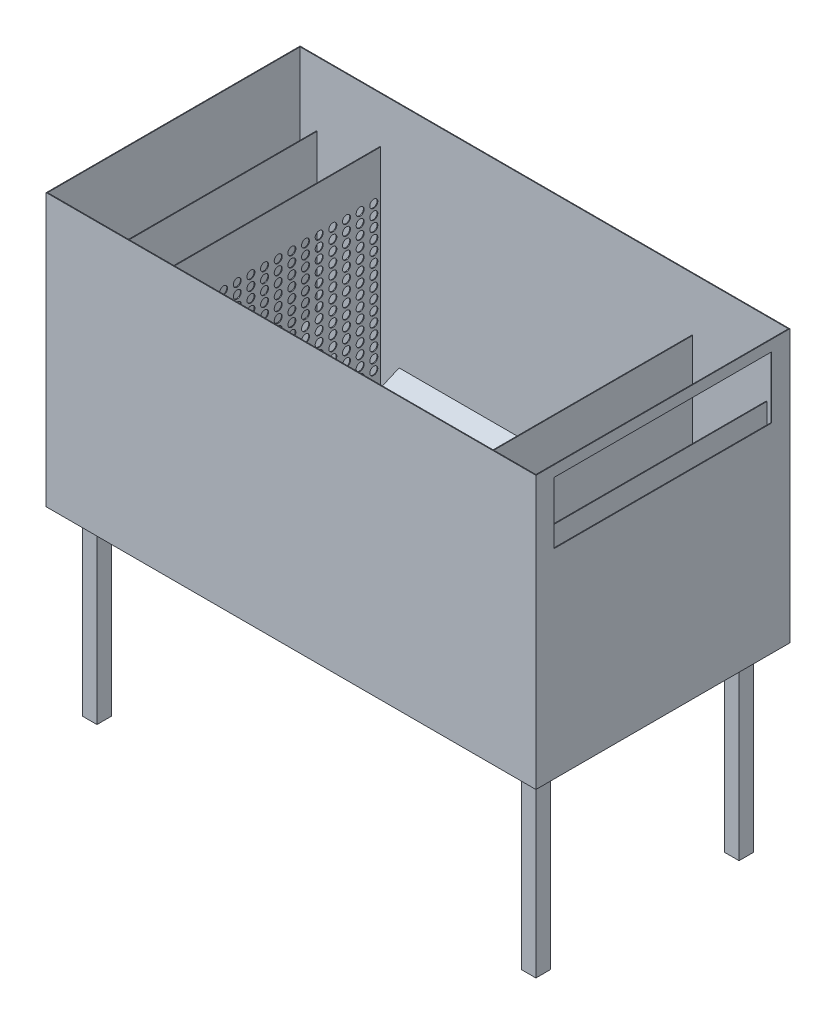
from build123d import *

# Parameters (mm, degrees)
MASTER_FOOTPRINT_W            = 1350
MASTER_FOOTPRINT_H            = 700
BATH_BASE_PLATE_DEPTH         = 750
BATH_SHELL_2MM_T              = -2
SKETCH_1_R                    = 50
INLET_D100_OPENING_DEPTH      = 10
INLET_IMPACT_BAFFLE_START     = 125
SKETCH_2_W                    = 540
SKETCH_2_H                    = 430
INLET_IMPACT_BAFFLE_DEPTH     = 2
DISTRIBUTOR_D22_START         = 250
SKETCH_3_W                    = 640
SKETCH_3_H                    = 648
SKETCH_3_R                    = 11
DISTRIBUTOR_D22_DEPTH         = 2
OUTLET_SUBMERGED_BAFFLE_START = 1130
SKETCH_4_W                    = 600
SKETCH_4_H                    = 330
OUTLET_SUBMERGED_BAFFLE_DEPTH = 2
OVERFLOW_WEIR_Z550_START      = 1290
SKETCH_5_W                    = 690
SKETCH_5_H                    = 548
OVERFLOW_WEIR_Z550_DEPTH      = 2
OUTLET_WEIR_SLOT_W600_START   = 1345
SKETCH_6_W                    = 600
SKETCH_6_H                    = 170
OUTLET_WEIR_SLOT_W600_DEPTH   = 10
SLOPED_SEDIMENT_FLOOR_START   = 275
SLOPED_SEDIMENT_FLOOR_DEPTH   = 825
SKETCH_8_W                    = 40
SKETCH_8_H                    = 40
FRAME_FOUR_LEGS_40X40_DEPTH   = 500
FRAME_FOUR_LEGS_40X40_2_DEPTH = 500
FRAME_FOUR_LEGS_40X40_3_DEPTH = 500
FRAME_FOUR_LEGS_40X40_4_DEPTH = 500


with BuildPart() as part:
    # MASTER_FOOTPRINT → BATH_BASE_PLATE (new body)
    with BuildSketch(Plane(origin=(0, 0, 0), x_dir=(1, 0, 0), z_dir=(0, 1, 0))):
        with Locations((675, 350)):
            Rectangle(MASTER_FOOTPRINT_W, MASTER_FOOTPRINT_H)
    extrude(amount=BATH_BASE_PLATE_DEPTH)

    # BATH_SHELL_2MM
    bath_shell_2mm_openings = [part.faces().sort_by_distance(p)[0] for p in [
        (675, 750, -350),
    ]]
    offset(amount=BATH_SHELL_2MM_T, openings=bath_shell_2mm_openings, kind=Kind.INTERSECTION)

    # Эскиз1 → INLET_D100_OPENING (cut)
    with BuildSketch(Plane(origin=(0, 0, 0), x_dir=(0, 0, -1), z_dir=(1, 0, 0))):
        with Locations((350, 420)):
            Circle(SKETCH_1_R)
    extrude(amount=INLET_D100_OPENING_DEPTH, mode=Mode.SUBTRACT)

    # Эскиз6 → OUTLET_WEIR_SLOT_W600 (cut)
    with BuildSketch(Plane(origin=(0, 0, 0), x_dir=(0, 0, -1), z_dir=(1, 0, 0)).offset(OUTLET_WEIR_SLOT_W600_START)):
        with Locations((350, 635)):
            Rectangle(SKETCH_6_W, SKETCH_6_H)
    extrude(amount=OUTLET_WEIR_SLOT_W600_DEPTH, mode=Mode.SUBTRACT)

    # Эскиз7 → SLOPED_SEDIMENT_FLOOR (add)
    with BuildSketch(Plane(origin=(0, 0, 0), x_dir=(0, 0, -1), z_dir=(1, 0, 0)).offset(SLOPED_SEDIMENT_FLOOR_START)):
        Polygon((2, -1), (2, 120), (280, -1), align=None)
        Polygon((698, -1), (698, 120), (420, -1), align=None)
    extrude(amount=SLOPED_SEDIMENT_FLOOR_DEPTH)


with BuildPart() as body_2:
    # Эскиз2 → INLET_IMPACT_BAFFLE (new body)
    with BuildSketch(Plane(origin=(0, 0, 0), x_dir=(0, 0, -1), z_dir=(1, 0, 0)).offset(INLET_IMPACT_BAFFLE_START)):
        with Locations((350, 435)):
            Rectangle(SKETCH_2_W, SKETCH_2_H)
    extrude(amount=INLET_IMPACT_BAFFLE_DEPTH)


with BuildPart() as body_3:
    # Эскиз3 → DISTRIBUTOR_D22 (new body)
    with BuildSketch(Plane(origin=(0, 0, 0), x_dir=(0, 0, -1), z_dir=(1, 0, 0)).offset(DISTRIBUTOR_D22_START)):
        with Locations((350, 326)):
            Rectangle(SKETCH_3_W, SKETCH_3_H)
        with Locations((48.823529412, 125)):
            Circle(SKETCH_3_R, mode=Mode.SUBTRACT)
        with Locations((48.823529412, 153.5)):
            Circle(SKETCH_3_R, mode=Mode.SUBTRACT)
        with Locations((48.823529412, 182)):
            Circle(SKETCH_3_R, mode=Mode.SUBTRACT)
        with Locations((48.823529412, 210.5)):
            Circle(SKETCH_3_R, mode=Mode.SUBTRACT)
        with Locations((48.823529412, 239)):
            Circle(SKETCH_3_R, mode=Mode.SUBTRACT)
        with Locations((48.823529412, 267.5)):
            Circle(SKETCH_3_R, mode=Mode.SUBTRACT)
        with Locations((48.823529412, 296)):
            Circle(SKETCH_3_R, mode=Mode.SUBTRACT)
        with Locations((48.823529412, 324.5)):
            Circle(SKETCH_3_R, mode=Mode.SUBTRACT)
        with Locations((48.823529412, 353)):
            Circle(SKETCH_3_R, mode=Mode.SUBTRACT)
        with Locations((48.823529412, 381.5)):
            Circle(SKETCH_3_R, mode=Mode.SUBTRACT)
        with Locations((48.823529412, 410)):
            Circle(SKETCH_3_R, mode=Mode.SUBTRACT)
        with Locations((48.823529412, 438.5)):
            Circle(SKETCH_3_R, mode=Mode.SUBTRACT)
        with Locations((48.823529412, 467)):
            Circle(SKETCH_3_R, mode=Mode.SUBTRACT)
        with Locations((48.823529412, 495.5)):
            Circle(SKETCH_3_R, mode=Mode.SUBTRACT)
        with Locations((48.823529412, 524)):
            Circle(SKETCH_3_R, mode=Mode.SUBTRACT)
        with Locations((86.470588235, 125)):
            Circle(SKETCH_3_R, mode=Mode.SUBTRACT)
        with Locations((86.470588235, 153.5)):
            Circle(SKETCH_3_R, mode=Mode.SUBTRACT)
        with Locations((86.470588235, 182)):
            Circle(SKETCH_3_R, mode=Mode.SUBTRACT)
        with Locations((86.470588235, 210.5)):
            Circle(SKETCH_3_R, mode=Mode.SUBTRACT)
        with Locations((86.470588235, 239)):
            Circle(SKETCH_3_R, mode=Mode.SUBTRACT)
        with Locations((86.470588235, 267.5)):
            Circle(SKETCH_3_R, mode=Mode.SUBTRACT)
        with Locations((86.470588235, 296)):
            Circle(SKETCH_3_R, mode=Mode.SUBTRACT)
        with Locations((86.470588235, 324.5)):
            Circle(SKETCH_3_R, mode=Mode.SUBTRACT)
        with Locations((86.470588235, 353)):
            Circle(SKETCH_3_R, mode=Mode.SUBTRACT)
        with Locations((86.470588235, 381.5)):
            Circle(SKETCH_3_R, mode=Mode.SUBTRACT)
        with Locations((86.470588235, 410)):
            Circle(SKETCH_3_R, mode=Mode.SUBTRACT)
        with Locations((86.470588235, 438.5)):
            Circle(SKETCH_3_R, mode=Mode.SUBTRACT)
        with Locations((86.470588235, 467)):
            Circle(SKETCH_3_R, mode=Mode.SUBTRACT)
        with Locations((86.470588235, 495.5)):
            Circle(SKETCH_3_R, mode=Mode.SUBTRACT)
        with Locations((86.470588235, 524)):
            Circle(SKETCH_3_R, mode=Mode.SUBTRACT)
        with Locations((124.117647059, 125)):
            Circle(SKETCH_3_R, mode=Mode.SUBTRACT)
        with Locations((124.117647059, 153.5)):
            Circle(SKETCH_3_R, mode=Mode.SUBTRACT)
        with Locations((124.117647059, 182)):
            Circle(SKETCH_3_R, mode=Mode.SUBTRACT)
        with Locations((124.117647059, 210.5)):
            Circle(SKETCH_3_R, mode=Mode.SUBTRACT)
        with Locations((124.117647059, 239)):
            Circle(SKETCH_3_R, mode=Mode.SUBTRACT)
        with Locations((124.117647059, 267.5)):
            Circle(SKETCH_3_R, mode=Mode.SUBTRACT)
        with Locations((124.117647059, 296)):
            Circle(SKETCH_3_R, mode=Mode.SUBTRACT)
        with Locations((124.117647059, 324.5)):
            Circle(SKETCH_3_R, mode=Mode.SUBTRACT)
        with Locations((124.117647059, 353)):
            Circle(SKETCH_3_R, mode=Mode.SUBTRACT)
        with Locations((124.117647059, 381.5)):
            Circle(SKETCH_3_R, mode=Mode.SUBTRACT)
        with Locations((124.117647059, 410)):
            Circle(SKETCH_3_R, mode=Mode.SUBTRACT)
        with Locations((124.117647059, 438.5)):
            Circle(SKETCH_3_R, mode=Mode.SUBTRACT)
        with Locations((124.117647059, 467)):
            Circle(SKETCH_3_R, mode=Mode.SUBTRACT)
        with Locations((124.117647059, 495.5)):
            Circle(SKETCH_3_R, mode=Mode.SUBTRACT)
        with Locations((124.117647059, 524)):
            Circle(SKETCH_3_R, mode=Mode.SUBTRACT)
        with Locations((161.764705882, 125)):
            Circle(SKETCH_3_R, mode=Mode.SUBTRACT)
        with Locations((161.764705882, 153.5)):
            Circle(SKETCH_3_R, mode=Mode.SUBTRACT)
        with Locations((161.764705882, 182)):
            Circle(SKETCH_3_R, mode=Mode.SUBTRACT)
        with Locations((161.764705882, 210.5)):
            Circle(SKETCH_3_R, mode=Mode.SUBTRACT)
        with Locations((161.764705882, 239)):
            Circle(SKETCH_3_R, mode=Mode.SUBTRACT)
        with Locations((161.764705882, 267.5)):
            Circle(SKETCH_3_R, mode=Mode.SUBTRACT)
        with Locations((161.764705882, 296)):
            Circle(SKETCH_3_R, mode=Mode.SUBTRACT)
        with Locations((161.764705882, 324.5)):
            Circle(SKETCH_3_R, mode=Mode.SUBTRACT)
        with Locations((161.764705882, 353)):
            Circle(SKETCH_3_R, mode=Mode.SUBTRACT)
        with Locations((161.764705882, 381.5)):
            Circle(SKETCH_3_R, mode=Mode.SUBTRACT)
        with Locations((161.764705882, 410)):
            Circle(SKETCH_3_R, mode=Mode.SUBTRACT)
        with Locations((161.764705882, 438.5)):
            Circle(SKETCH_3_R, mode=Mode.SUBTRACT)
        with Locations((161.764705882, 467)):
            Circle(SKETCH_3_R, mode=Mode.SUBTRACT)
        with Locations((161.764705882, 495.5)):
            Circle(SKETCH_3_R, mode=Mode.SUBTRACT)
        with Locations((161.764705882, 524)):
            Circle(SKETCH_3_R, mode=Mode.SUBTRACT)
        with Locations((199.411764706, 125)):
            Circle(SKETCH_3_R, mode=Mode.SUBTRACT)
        with Locations((199.411764706, 153.5)):
            Circle(SKETCH_3_R, mode=Mode.SUBTRACT)
        with Locations((199.411764706, 182)):
            Circle(SKETCH_3_R, mode=Mode.SUBTRACT)
        with Locations((199.411764706, 210.5)):
            Circle(SKETCH_3_R, mode=Mode.SUBTRACT)
        with Locations((199.411764706, 239)):
            Circle(SKETCH_3_R, mode=Mode.SUBTRACT)
        with Locations((199.411764706, 267.5)):
            Circle(SKETCH_3_R, mode=Mode.SUBTRACT)
        with Locations((199.411764706, 296)):
            Circle(SKETCH_3_R, mode=Mode.SUBTRACT)
        with Locations((199.411764706, 324.5)):
            Circle(SKETCH_3_R, mode=Mode.SUBTRACT)
        with Locations((199.411764706, 353)):
            Circle(SKETCH_3_R, mode=Mode.SUBTRACT)
        with Locations((199.411764706, 381.5)):
            Circle(SKETCH_3_R, mode=Mode.SUBTRACT)
        with Locations((199.411764706, 410)):
            Circle(SKETCH_3_R, mode=Mode.SUBTRACT)
        with Locations((199.411764706, 438.5)):
            Circle(SKETCH_3_R, mode=Mode.SUBTRACT)
        with Locations((199.411764706, 467)):
            Circle(SKETCH_3_R, mode=Mode.SUBTRACT)
        with Locations((199.411764706, 495.5)):
            Circle(SKETCH_3_R, mode=Mode.SUBTRACT)
        with Locations((199.411764706, 524)):
            Circle(SKETCH_3_R, mode=Mode.SUBTRACT)
        with Locations((237.058823529, 125)):
            Circle(SKETCH_3_R, mode=Mode.SUBTRACT)
        with Locations((237.058823529, 153.5)):
            Circle(SKETCH_3_R, mode=Mode.SUBTRACT)
        with Locations((237.058823529, 182)):
            Circle(SKETCH_3_R, mode=Mode.SUBTRACT)
        with Locations((237.058823529, 210.5)):
            Circle(SKETCH_3_R, mode=Mode.SUBTRACT)
        with Locations((237.058823529, 239)):
            Circle(SKETCH_3_R, mode=Mode.SUBTRACT)
        with Locations((237.058823529, 267.5)):
            Circle(SKETCH_3_R, mode=Mode.SUBTRACT)
        with Locations((237.058823529, 296)):
            Circle(SKETCH_3_R, mode=Mode.SUBTRACT)
        with Locations((237.058823529, 324.5)):
            Circle(SKETCH_3_R, mode=Mode.SUBTRACT)
        with Locations((237.058823529, 353)):
            Circle(SKETCH_3_R, mode=Mode.SUBTRACT)
        with Locations((237.058823529, 381.5)):
            Circle(SKETCH_3_R, mode=Mode.SUBTRACT)
        with Locations((237.058823529, 410)):
            Circle(SKETCH_3_R, mode=Mode.SUBTRACT)
        with Locations((237.058823529, 438.5)):
            Circle(SKETCH_3_R, mode=Mode.SUBTRACT)
        with Locations((237.058823529, 467)):
            Circle(SKETCH_3_R, mode=Mode.SUBTRACT)
        with Locations((237.058823529, 495.5)):
            Circle(SKETCH_3_R, mode=Mode.SUBTRACT)
        with Locations((237.058823529, 524)):
            Circle(SKETCH_3_R, mode=Mode.SUBTRACT)
        with Locations((274.705882353, 125)):
            Circle(SKETCH_3_R, mode=Mode.SUBTRACT)
        with Locations((274.705882353, 153.5)):
            Circle(SKETCH_3_R, mode=Mode.SUBTRACT)
        with Locations((274.705882353, 182)):
            Circle(SKETCH_3_R, mode=Mode.SUBTRACT)
        with Locations((274.705882353, 210.5)):
            Circle(SKETCH_3_R, mode=Mode.SUBTRACT)
        with Locations((274.705882353, 239)):
            Circle(SKETCH_3_R, mode=Mode.SUBTRACT)
        with Locations((274.705882353, 267.5)):
            Circle(SKETCH_3_R, mode=Mode.SUBTRACT)
        with Locations((274.705882353, 296)):
            Circle(SKETCH_3_R, mode=Mode.SUBTRACT)
        with Locations((274.705882353, 324.5)):
            Circle(SKETCH_3_R, mode=Mode.SUBTRACT)
        with Locations((274.705882353, 353)):
            Circle(SKETCH_3_R, mode=Mode.SUBTRACT)
        with Locations((274.705882353, 381.5)):
            Circle(SKETCH_3_R, mode=Mode.SUBTRACT)
        with Locations((274.705882353, 410)):
            Circle(SKETCH_3_R, mode=Mode.SUBTRACT)
        with Locations((274.705882353, 438.5)):
            Circle(SKETCH_3_R, mode=Mode.SUBTRACT)
        with Locations((274.705882353, 467)):
            Circle(SKETCH_3_R, mode=Mode.SUBTRACT)
        with Locations((274.705882353, 495.5)):
            Circle(SKETCH_3_R, mode=Mode.SUBTRACT)
        with Locations((274.705882353, 524)):
            Circle(SKETCH_3_R, mode=Mode.SUBTRACT)
        with Locations((312.352941176, 125)):
            Circle(SKETCH_3_R, mode=Mode.SUBTRACT)
        with Locations((312.352941176, 153.5)):
            Circle(SKETCH_3_R, mode=Mode.SUBTRACT)
        with Locations((312.352941176, 182)):
            Circle(SKETCH_3_R, mode=Mode.SUBTRACT)
        with Locations((312.352941176, 210.5)):
            Circle(SKETCH_3_R, mode=Mode.SUBTRACT)
        with Locations((312.352941176, 239)):
            Circle(SKETCH_3_R, mode=Mode.SUBTRACT)
        with Locations((312.352941176, 267.5)):
            Circle(SKETCH_3_R, mode=Mode.SUBTRACT)
        with Locations((312.352941176, 296)):
            Circle(SKETCH_3_R, mode=Mode.SUBTRACT)
        with Locations((312.352941176, 324.5)):
            Circle(SKETCH_3_R, mode=Mode.SUBTRACT)
        with Locations((312.352941176, 353)):
            Circle(SKETCH_3_R, mode=Mode.SUBTRACT)
        with Locations((312.352941176, 381.5)):
            Circle(SKETCH_3_R, mode=Mode.SUBTRACT)
        with Locations((312.352941176, 410)):
            Circle(SKETCH_3_R, mode=Mode.SUBTRACT)
        with Locations((312.352941176, 438.5)):
            Circle(SKETCH_3_R, mode=Mode.SUBTRACT)
        with Locations((312.352941176, 467)):
            Circle(SKETCH_3_R, mode=Mode.SUBTRACT)
        with Locations((312.352941176, 495.5)):
            Circle(SKETCH_3_R, mode=Mode.SUBTRACT)
        with Locations((312.352941176, 524)):
            Circle(SKETCH_3_R, mode=Mode.SUBTRACT)
        with Locations((350, 125)):
            Circle(SKETCH_3_R, mode=Mode.SUBTRACT)
        with Locations((350, 153.5)):
            Circle(SKETCH_3_R, mode=Mode.SUBTRACT)
        with Locations((350, 182)):
            Circle(SKETCH_3_R, mode=Mode.SUBTRACT)
        with Locations((350, 210.5)):
            Circle(SKETCH_3_R, mode=Mode.SUBTRACT)
        with Locations((350, 239)):
            Circle(SKETCH_3_R, mode=Mode.SUBTRACT)
        with Locations((350, 267.5)):
            Circle(SKETCH_3_R, mode=Mode.SUBTRACT)
        with Locations((350, 296)):
            Circle(SKETCH_3_R, mode=Mode.SUBTRACT)
        with Locations((350, 324.5)):
            Circle(SKETCH_3_R, mode=Mode.SUBTRACT)
        with Locations((350, 353)):
            Circle(SKETCH_3_R, mode=Mode.SUBTRACT)
        with Locations((350, 381.5)):
            Circle(SKETCH_3_R, mode=Mode.SUBTRACT)
        with Locations((350, 410)):
            Circle(SKETCH_3_R, mode=Mode.SUBTRACT)
        with Locations((350, 438.5)):
            Circle(SKETCH_3_R, mode=Mode.SUBTRACT)
        with Locations((350, 467)):
            Circle(SKETCH_3_R, mode=Mode.SUBTRACT)
        with Locations((350, 495.5)):
            Circle(SKETCH_3_R, mode=Mode.SUBTRACT)
        with Locations((350, 524)):
            Circle(SKETCH_3_R, mode=Mode.SUBTRACT)
        with Locations((387.647058824, 125)):
            Circle(SKETCH_3_R, mode=Mode.SUBTRACT)
        with Locations((387.647058824, 153.5)):
            Circle(SKETCH_3_R, mode=Mode.SUBTRACT)
        with Locations((387.647058824, 182)):
            Circle(SKETCH_3_R, mode=Mode.SUBTRACT)
        with Locations((387.647058824, 210.5)):
            Circle(SKETCH_3_R, mode=Mode.SUBTRACT)
        with Locations((387.647058824, 239)):
            Circle(SKETCH_3_R, mode=Mode.SUBTRACT)
        with Locations((387.647058824, 267.5)):
            Circle(SKETCH_3_R, mode=Mode.SUBTRACT)
        with Locations((387.647058824, 296)):
            Circle(SKETCH_3_R, mode=Mode.SUBTRACT)
        with Locations((387.647058824, 324.5)):
            Circle(SKETCH_3_R, mode=Mode.SUBTRACT)
        with Locations((387.647058824, 353)):
            Circle(SKETCH_3_R, mode=Mode.SUBTRACT)
        with Locations((387.647058824, 381.5)):
            Circle(SKETCH_3_R, mode=Mode.SUBTRACT)
        with Locations((387.647058824, 410)):
            Circle(SKETCH_3_R, mode=Mode.SUBTRACT)
        with Locations((387.647058824, 438.5)):
            Circle(SKETCH_3_R, mode=Mode.SUBTRACT)
        with Locations((387.647058824, 467)):
            Circle(SKETCH_3_R, mode=Mode.SUBTRACT)
        with Locations((387.647058824, 495.5)):
            Circle(SKETCH_3_R, mode=Mode.SUBTRACT)
        with Locations((387.647058824, 524)):
            Circle(SKETCH_3_R, mode=Mode.SUBTRACT)
        with Locations((425.294117647, 125)):
            Circle(SKETCH_3_R, mode=Mode.SUBTRACT)
        with Locations((425.294117647, 153.5)):
            Circle(SKETCH_3_R, mode=Mode.SUBTRACT)
        with Locations((425.294117647, 182)):
            Circle(SKETCH_3_R, mode=Mode.SUBTRACT)
        with Locations((425.294117647, 210.5)):
            Circle(SKETCH_3_R, mode=Mode.SUBTRACT)
        with Locations((425.294117647, 239)):
            Circle(SKETCH_3_R, mode=Mode.SUBTRACT)
        with Locations((425.294117647, 267.5)):
            Circle(SKETCH_3_R, mode=Mode.SUBTRACT)
        with Locations((425.294117647, 296)):
            Circle(SKETCH_3_R, mode=Mode.SUBTRACT)
        with Locations((425.294117647, 324.5)):
            Circle(SKETCH_3_R, mode=Mode.SUBTRACT)
        with Locations((425.294117647, 353)):
            Circle(SKETCH_3_R, mode=Mode.SUBTRACT)
        with Locations((425.294117647, 381.5)):
            Circle(SKETCH_3_R, mode=Mode.SUBTRACT)
        with Locations((425.294117647, 410)):
            Circle(SKETCH_3_R, mode=Mode.SUBTRACT)
        with Locations((425.294117647, 438.5)):
            Circle(SKETCH_3_R, mode=Mode.SUBTRACT)
        with Locations((425.294117647, 467)):
            Circle(SKETCH_3_R, mode=Mode.SUBTRACT)
        with Locations((425.294117647, 495.5)):
            Circle(SKETCH_3_R, mode=Mode.SUBTRACT)
        with Locations((425.294117647, 524)):
            Circle(SKETCH_3_R, mode=Mode.SUBTRACT)
        with Locations((462.941176471, 125)):
            Circle(SKETCH_3_R, mode=Mode.SUBTRACT)
        with Locations((462.941176471, 153.5)):
            Circle(SKETCH_3_R, mode=Mode.SUBTRACT)
        with Locations((462.941176471, 182)):
            Circle(SKETCH_3_R, mode=Mode.SUBTRACT)
        with Locations((462.941176471, 210.5)):
            Circle(SKETCH_3_R, mode=Mode.SUBTRACT)
        with Locations((462.941176471, 239)):
            Circle(SKETCH_3_R, mode=Mode.SUBTRACT)
        with Locations((462.941176471, 267.5)):
            Circle(SKETCH_3_R, mode=Mode.SUBTRACT)
        with Locations((462.941176471, 296)):
            Circle(SKETCH_3_R, mode=Mode.SUBTRACT)
        with Locations((462.941176471, 324.5)):
            Circle(SKETCH_3_R, mode=Mode.SUBTRACT)
        with Locations((462.941176471, 353)):
            Circle(SKETCH_3_R, mode=Mode.SUBTRACT)
        with Locations((462.941176471, 381.5)):
            Circle(SKETCH_3_R, mode=Mode.SUBTRACT)
        with Locations((462.941176471, 410)):
            Circle(SKETCH_3_R, mode=Mode.SUBTRACT)
        with Locations((462.941176471, 438.5)):
            Circle(SKETCH_3_R, mode=Mode.SUBTRACT)
        with Locations((462.941176471, 467)):
            Circle(SKETCH_3_R, mode=Mode.SUBTRACT)
        with Locations((462.941176471, 495.5)):
            Circle(SKETCH_3_R, mode=Mode.SUBTRACT)
        with Locations((462.941176471, 524)):
            Circle(SKETCH_3_R, mode=Mode.SUBTRACT)
        with Locations((500.588235294, 125)):
            Circle(SKETCH_3_R, mode=Mode.SUBTRACT)
        with Locations((500.588235294, 153.5)):
            Circle(SKETCH_3_R, mode=Mode.SUBTRACT)
        with Locations((500.588235294, 182)):
            Circle(SKETCH_3_R, mode=Mode.SUBTRACT)
        with Locations((500.588235294, 210.5)):
            Circle(SKETCH_3_R, mode=Mode.SUBTRACT)
        with Locations((500.588235294, 239)):
            Circle(SKETCH_3_R, mode=Mode.SUBTRACT)
        with Locations((500.588235294, 267.5)):
            Circle(SKETCH_3_R, mode=Mode.SUBTRACT)
        with Locations((500.588235294, 296)):
            Circle(SKETCH_3_R, mode=Mode.SUBTRACT)
        with Locations((500.588235294, 324.5)):
            Circle(SKETCH_3_R, mode=Mode.SUBTRACT)
        with Locations((500.588235294, 353)):
            Circle(SKETCH_3_R, mode=Mode.SUBTRACT)
        with Locations((500.588235294, 381.5)):
            Circle(SKETCH_3_R, mode=Mode.SUBTRACT)
        with Locations((500.588235294, 410)):
            Circle(SKETCH_3_R, mode=Mode.SUBTRACT)
        with Locations((500.588235294, 438.5)):
            Circle(SKETCH_3_R, mode=Mode.SUBTRACT)
        with Locations((500.588235294, 467)):
            Circle(SKETCH_3_R, mode=Mode.SUBTRACT)
        with Locations((500.588235294, 495.5)):
            Circle(SKETCH_3_R, mode=Mode.SUBTRACT)
        with Locations((500.588235294, 524)):
            Circle(SKETCH_3_R, mode=Mode.SUBTRACT)
        with Locations((538.235294118, 125)):
            Circle(SKETCH_3_R, mode=Mode.SUBTRACT)
        with Locations((538.235294118, 153.5)):
            Circle(SKETCH_3_R, mode=Mode.SUBTRACT)
        with Locations((538.235294118, 182)):
            Circle(SKETCH_3_R, mode=Mode.SUBTRACT)
        with Locations((538.235294118, 210.5)):
            Circle(SKETCH_3_R, mode=Mode.SUBTRACT)
        with Locations((538.235294118, 239)):
            Circle(SKETCH_3_R, mode=Mode.SUBTRACT)
        with Locations((538.235294118, 267.5)):
            Circle(SKETCH_3_R, mode=Mode.SUBTRACT)
        with Locations((538.235294118, 296)):
            Circle(SKETCH_3_R, mode=Mode.SUBTRACT)
        with Locations((538.235294118, 324.5)):
            Circle(SKETCH_3_R, mode=Mode.SUBTRACT)
        with Locations((538.235294118, 353)):
            Circle(SKETCH_3_R, mode=Mode.SUBTRACT)
        with Locations((538.235294118, 381.5)):
            Circle(SKETCH_3_R, mode=Mode.SUBTRACT)
        with Locations((538.235294118, 410)):
            Circle(SKETCH_3_R, mode=Mode.SUBTRACT)
        with Locations((538.235294118, 438.5)):
            Circle(SKETCH_3_R, mode=Mode.SUBTRACT)
        with Locations((538.235294118, 467)):
            Circle(SKETCH_3_R, mode=Mode.SUBTRACT)
        with Locations((538.235294118, 495.5)):
            Circle(SKETCH_3_R, mode=Mode.SUBTRACT)
        with Locations((538.235294118, 524)):
            Circle(SKETCH_3_R, mode=Mode.SUBTRACT)
        with Locations((575.882352941, 125)):
            Circle(SKETCH_3_R, mode=Mode.SUBTRACT)
        with Locations((575.882352941, 153.5)):
            Circle(SKETCH_3_R, mode=Mode.SUBTRACT)
        with Locations((575.882352941, 182)):
            Circle(SKETCH_3_R, mode=Mode.SUBTRACT)
        with Locations((575.882352941, 210.5)):
            Circle(SKETCH_3_R, mode=Mode.SUBTRACT)
        with Locations((575.882352941, 239)):
            Circle(SKETCH_3_R, mode=Mode.SUBTRACT)
        with Locations((575.882352941, 267.5)):
            Circle(SKETCH_3_R, mode=Mode.SUBTRACT)
        with Locations((575.882352941, 296)):
            Circle(SKETCH_3_R, mode=Mode.SUBTRACT)
        with Locations((575.882352941, 324.5)):
            Circle(SKETCH_3_R, mode=Mode.SUBTRACT)
        with Locations((575.882352941, 353)):
            Circle(SKETCH_3_R, mode=Mode.SUBTRACT)
        with Locations((575.882352941, 381.5)):
            Circle(SKETCH_3_R, mode=Mode.SUBTRACT)
        with Locations((575.882352941, 410)):
            Circle(SKETCH_3_R, mode=Mode.SUBTRACT)
        with Locations((575.882352941, 438.5)):
            Circle(SKETCH_3_R, mode=Mode.SUBTRACT)
        with Locations((575.882352941, 467)):
            Circle(SKETCH_3_R, mode=Mode.SUBTRACT)
        with Locations((575.882352941, 495.5)):
            Circle(SKETCH_3_R, mode=Mode.SUBTRACT)
        with Locations((575.882352941, 524)):
            Circle(SKETCH_3_R, mode=Mode.SUBTRACT)
        with Locations((613.529411765, 125)):
            Circle(SKETCH_3_R, mode=Mode.SUBTRACT)
        with Locations((613.529411765, 153.5)):
            Circle(SKETCH_3_R, mode=Mode.SUBTRACT)
        with Locations((613.529411765, 182)):
            Circle(SKETCH_3_R, mode=Mode.SUBTRACT)
        with Locations((613.529411765, 210.5)):
            Circle(SKETCH_3_R, mode=Mode.SUBTRACT)
        with Locations((613.529411765, 239)):
            Circle(SKETCH_3_R, mode=Mode.SUBTRACT)
        with Locations((613.529411765, 267.5)):
            Circle(SKETCH_3_R, mode=Mode.SUBTRACT)
        with Locations((613.529411765, 296)):
            Circle(SKETCH_3_R, mode=Mode.SUBTRACT)
        with Locations((613.529411765, 324.5)):
            Circle(SKETCH_3_R, mode=Mode.SUBTRACT)
        with Locations((613.529411765, 353)):
            Circle(SKETCH_3_R, mode=Mode.SUBTRACT)
        with Locations((613.529411765, 381.5)):
            Circle(SKETCH_3_R, mode=Mode.SUBTRACT)
        with Locations((613.529411765, 410)):
            Circle(SKETCH_3_R, mode=Mode.SUBTRACT)
        with Locations((613.529411765, 438.5)):
            Circle(SKETCH_3_R, mode=Mode.SUBTRACT)
        with Locations((613.529411765, 467)):
            Circle(SKETCH_3_R, mode=Mode.SUBTRACT)
        with Locations((613.529411765, 495.5)):
            Circle(SKETCH_3_R, mode=Mode.SUBTRACT)
        with Locations((613.529411765, 524)):
            Circle(SKETCH_3_R, mode=Mode.SUBTRACT)
        with Locations((651.176470588, 125)):
            Circle(SKETCH_3_R, mode=Mode.SUBTRACT)
        with Locations((651.176470588, 153.5)):
            Circle(SKETCH_3_R, mode=Mode.SUBTRACT)
        with Locations((651.176470588, 182)):
            Circle(SKETCH_3_R, mode=Mode.SUBTRACT)
        with Locations((651.176470588, 210.5)):
            Circle(SKETCH_3_R, mode=Mode.SUBTRACT)
        with Locations((651.176470588, 239)):
            Circle(SKETCH_3_R, mode=Mode.SUBTRACT)
        with Locations((651.176470588, 267.5)):
            Circle(SKETCH_3_R, mode=Mode.SUBTRACT)
        with Locations((651.176470588, 296)):
            Circle(SKETCH_3_R, mode=Mode.SUBTRACT)
        with Locations((651.176470588, 324.5)):
            Circle(SKETCH_3_R, mode=Mode.SUBTRACT)
        with Locations((651.176470588, 353)):
            Circle(SKETCH_3_R, mode=Mode.SUBTRACT)
        with Locations((651.176470588, 381.5)):
            Circle(SKETCH_3_R, mode=Mode.SUBTRACT)
        with Locations((651.176470588, 410)):
            Circle(SKETCH_3_R, mode=Mode.SUBTRACT)
        with Locations((651.176470588, 438.5)):
            Circle(SKETCH_3_R, mode=Mode.SUBTRACT)
        with Locations((651.176470588, 467)):
            Circle(SKETCH_3_R, mode=Mode.SUBTRACT)
        with Locations((651.176470588, 495.5)):
            Circle(SKETCH_3_R, mode=Mode.SUBTRACT)
        with Locations((651.176470588, 524)):
            Circle(SKETCH_3_R, mode=Mode.SUBTRACT)
    extrude(amount=DISTRIBUTOR_D22_DEPTH)


with BuildPart() as body_4:
    # Эскиз4 → OUTLET_SUBMERGED_BAFFLE (new body)
    with BuildSketch(Plane(origin=(0, 0, 0), x_dir=(0, 0, -1), z_dir=(1, 0, 0)).offset(OUTLET_SUBMERGED_BAFFLE_START)):
        with Locations((350, 485)):
            Rectangle(SKETCH_4_W, SKETCH_4_H)
    extrude(amount=OUTLET_SUBMERGED_BAFFLE_DEPTH)


with BuildPart() as body_5:
    # Эскиз5 → OVERFLOW_WEIR_Z550 (new body)
    with BuildSketch(Plane(origin=(0, 0, 0), x_dir=(0, 0, -1), z_dir=(1, 0, 0)).offset(OVERFLOW_WEIR_Z550_START)):
        with Locations((350, 276)):
            Rectangle(SKETCH_5_W, SKETCH_5_H)
    extrude(amount=OVERFLOW_WEIR_Z550_DEPTH)


with BuildPart() as body_6:
    # Эскиз8 → FRAME_FOUR_LEGS_40X40 (new body)
    with BuildSketch(Plane(origin=(0, 0, 0), x_dir=(1, 0, 0), z_dir=(0, 1, 0))):
        with Locations((70, 70)):
            Rectangle(SKETCH_8_W, SKETCH_8_H)
    extrude(amount=-FRAME_FOUR_LEGS_40X40_DEPTH)


with BuildPart() as body_7:
    # Эскиз8 → FRAME_FOUR_LEGS_40X40 2 (new body)
    with BuildSketch(Plane(origin=(0, 0, 0), x_dir=(1, 0, 0), z_dir=(0, 1, 0))):
        with Locations((70, 630)):
            Rectangle(SKETCH_8_W, SKETCH_8_H)
    extrude(amount=-FRAME_FOUR_LEGS_40X40_2_DEPTH)


with BuildPart() as body_8:
    # Эскиз8 → FRAME_FOUR_LEGS_40X40 3 (new body)
    with BuildSketch(Plane(origin=(0, 0, 0), x_dir=(1, 0, 0), z_dir=(0, 1, 0))):
        with Locations((1280, 70)):
            Rectangle(SKETCH_8_W, SKETCH_8_H)
    extrude(amount=-FRAME_FOUR_LEGS_40X40_3_DEPTH)


with BuildPart() as body_9:
    # Эскиз8 → FRAME_FOUR_LEGS_40X40 4 (new body)
    with BuildSketch(Plane(origin=(0, 0, 0), x_dir=(1, 0, 0), z_dir=(0, 1, 0))):
        with Locations((1280, 630)):
            Rectangle(SKETCH_8_W, SKETCH_8_H)
    extrude(amount=-FRAME_FOUR_LEGS_40X40_4_DEPTH)


solid = Compound([part.part, body_2.part, body_3.part, body_4.part, body_5.part, body_6.part, body_7.part, body_8.part, body_9.part])
